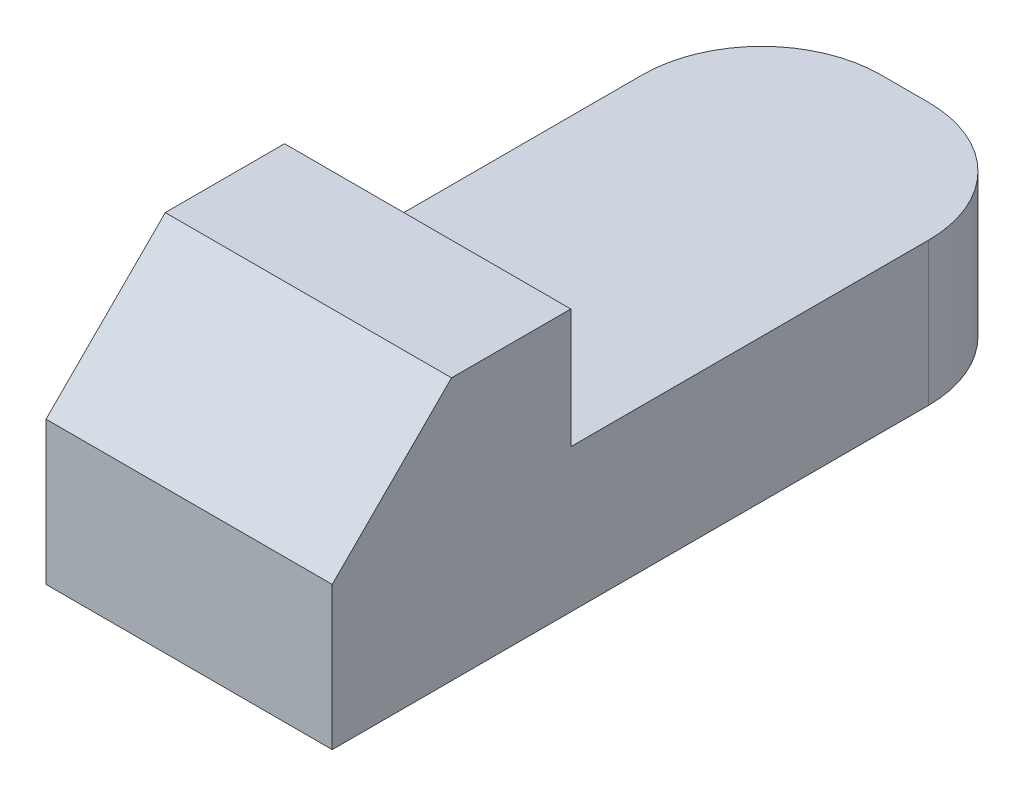
from build123d import *

# Parameters (mm, degrees)
SKETCH1_W           = 12
SKETCH1_H           = 6
BOSS_EXTRUDE1_DEPTH = 30
SKETCH2_W           = 12
SKETCH2_H           = 10
BOSS_EXTRUDE2_DEPTH = 5
CUT_EXTRUDE1_DEPTH  = 34.286633954
FILLET1_R           = 5


with BuildPart() as part:
    # Sketch1 → Boss-Extrude1 (new body)
    with BuildSketch(Plane.XY):
        Rectangle(SKETCH1_W, SKETCH1_H)
    extrude(amount=-BOSS_EXTRUDE1_DEPTH)

    # Sketch2 → Boss-Extrude2 (add)
    with BuildSketch(Plane(origin=(0, 3, 0), x_dir=(1, 0, 0), z_dir=(0, 1, 0))):
        with Locations((0, 5)):
            Rectangle(SKETCH2_W, SKETCH2_H)
    extrude(amount=BOSS_EXTRUDE2_DEPTH)

    # Sketch3 → Cut-Extrude1 (cut, through all)
    with BuildSketch(Plane(origin=(6, 0, 0), x_dir=(0, 0, -1), z_dir=(1, 0, 0))):
        Polygon((5, 8), (0, 3), (0, 8), align=None)
    extrude(amount=-CUT_EXTRUDE1_DEPTH, mode=Mode.SUBTRACT)

    # Fillet1
    fillet1_edges = [part.edges().sort_by_distance(p)[0] for p in [
        (-6, 0, -30),
        (6, 0, -30),
    ]]
    fillet(fillet1_edges, radius=FILLET1_R)


solid = part.part
